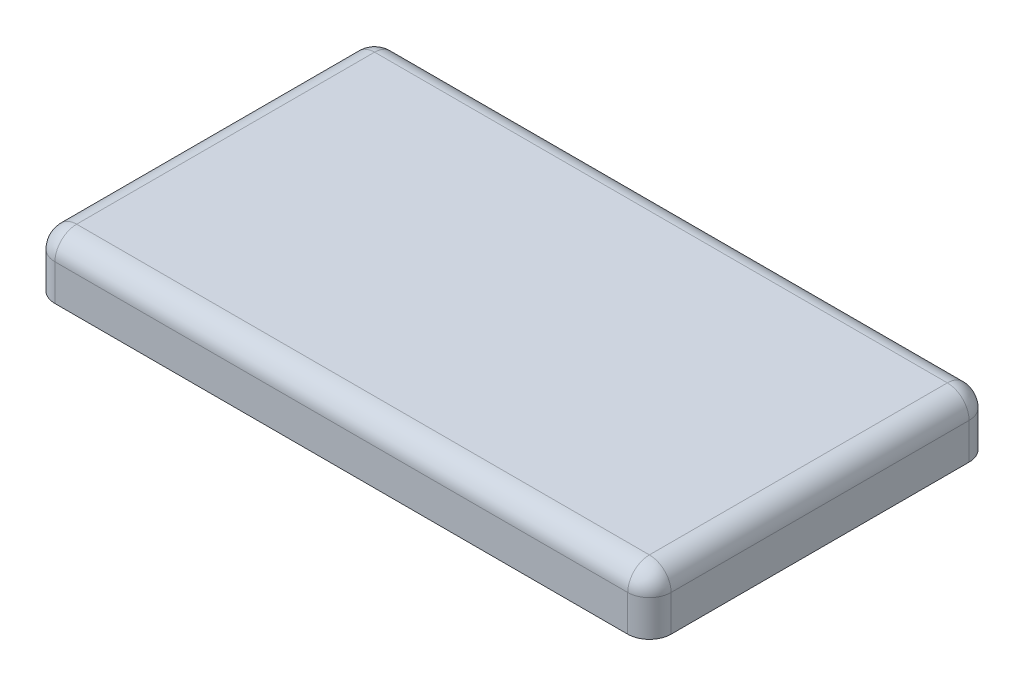
from build123d import *

# Parameters (mm, degrees)
SKETCH1_W           = 42.6
SKETCH1_H           = 23.6
BOSS_EXTRUDE1_DEPTH = 4
SKETCH2_W           = 40.1
SKETCH2_H           = 21.1
CUT_EXTRUDE1_DEPTH  = 2.6
FILLET1_R           = 1.5


with BuildPart() as part:
    # Sketch1 → Boss-Extrude1 (new body)
    with BuildSketch(Plane(origin=(0, 0, 0), x_dir=(1, 0, 0), z_dir=(0, 1, 0))):
        with Locations((21.3, 11.8)):
            Rectangle(SKETCH1_W, SKETCH1_H)
    extrude(amount=BOSS_EXTRUDE1_DEPTH)

    # Sketch2 → Cut-Extrude1 (cut)
    with BuildSketch(Plane.XZ):
        with Locations((21.3, -11.8)):
            Rectangle(SKETCH2_W, SKETCH2_H)
    extrude(amount=-CUT_EXTRUDE1_DEPTH, mode=Mode.SUBTRACT)

    # Fillet1
    fillet1_edges = [part.edges().sort_by_distance(p)[0] for p in [
        (42.6, 4, -11.8),
        (21.3, 4, -23.6),
        (0, 4, -11.8),
        (21.3, 4, 0),
        (0, 2, -23.6),
        (42.6, 2, -23.6),
        (42.6, 2, 0),
        (0, 2, 0),
    ]]
    fillet(fillet1_edges, radius=FILLET1_R)


solid = part.part
